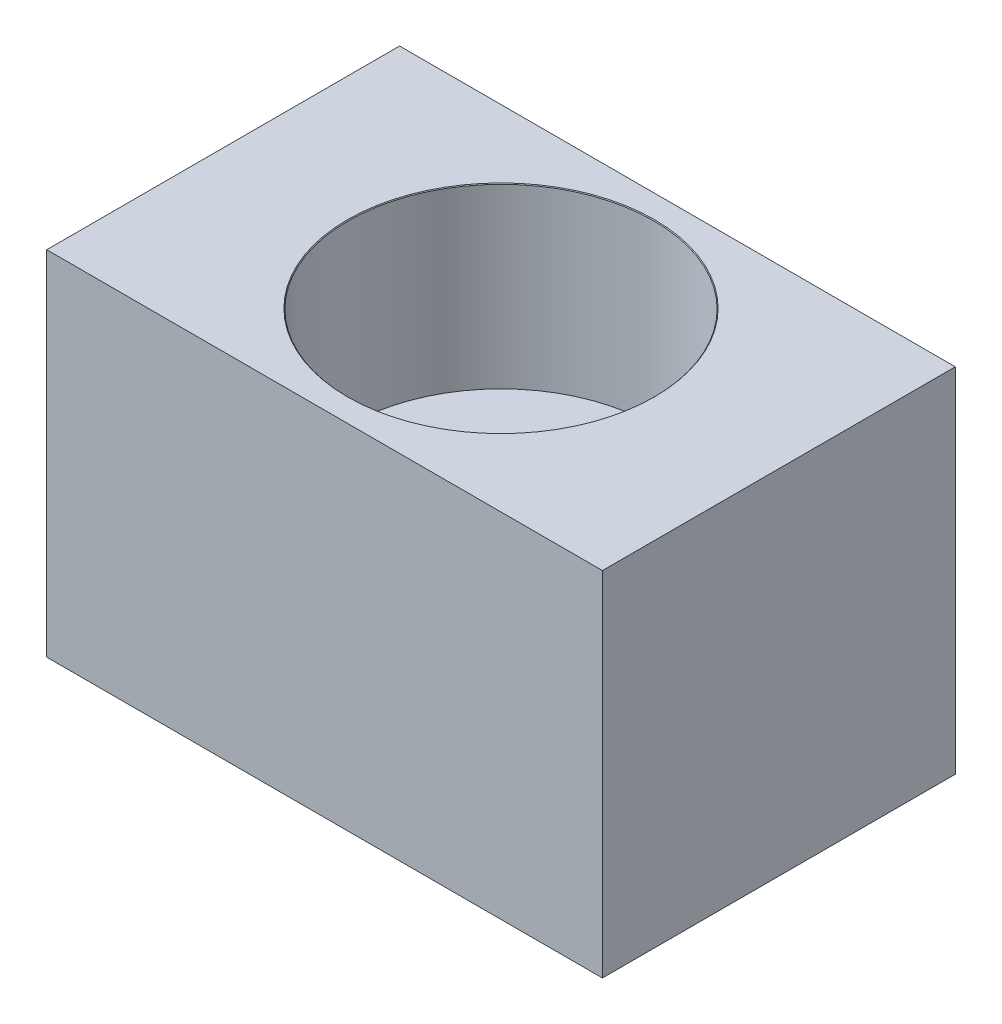
from build123d import *

# Parameters (mm, degrees)
CROQUIS1_W              = 20
CROQUIS1_H              = 12.7
SALIENTE_EXTRUIR1_DEPTH = 6.35


with BuildPart() as part:
    # Croquis1 → Saliente-Extruir1 (new, symmetric)
    with BuildSketch(Plane.XY):
        Rectangle(CROQUIS1_W, CROQUIS1_H)
    extrude(amount=SALIENTE_EXTRUIR1_DEPTH, both=True)

    # Croquis3 → Refrentado para tornillo con cabeza hueca de M61 (revolve, cut)
    with BuildSketch(Plane(origin=(0, 6.35, 0), x_dir=(0, 0, 1), z_dir=(1, 0, 0))):
        Polygon((0, 0), (0, 12.7), (3.325, 12.7), (3.3, 12.675), (3.3, 6.4), (5.5, 6.4), (5.5, 0.025), (5.525, 0), align=None)
    revolve(axis=Axis((0, 12.7, 0), (0, -1, 0)), mode=Mode.SUBTRACT)


solid = part.part
